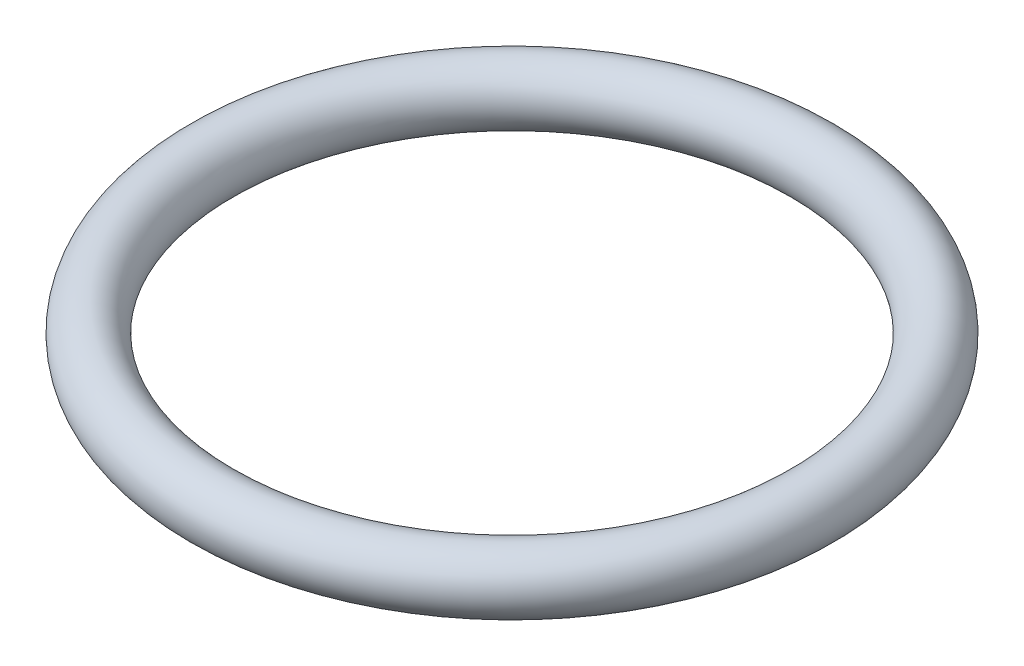
from build123d import *

# Parameters (mm, degrees)
SKETCH1_R = 1


with BuildPart() as part:
    # Sketch1 → Revolve1 (revolve)
    with BuildSketch(Plane.XY):
        with Locations((-10, 0)):
            Circle(SKETCH1_R)
    revolve(axis=Axis((0, 14.080317926, 0), (0, -1, 0)))


solid = part.part
